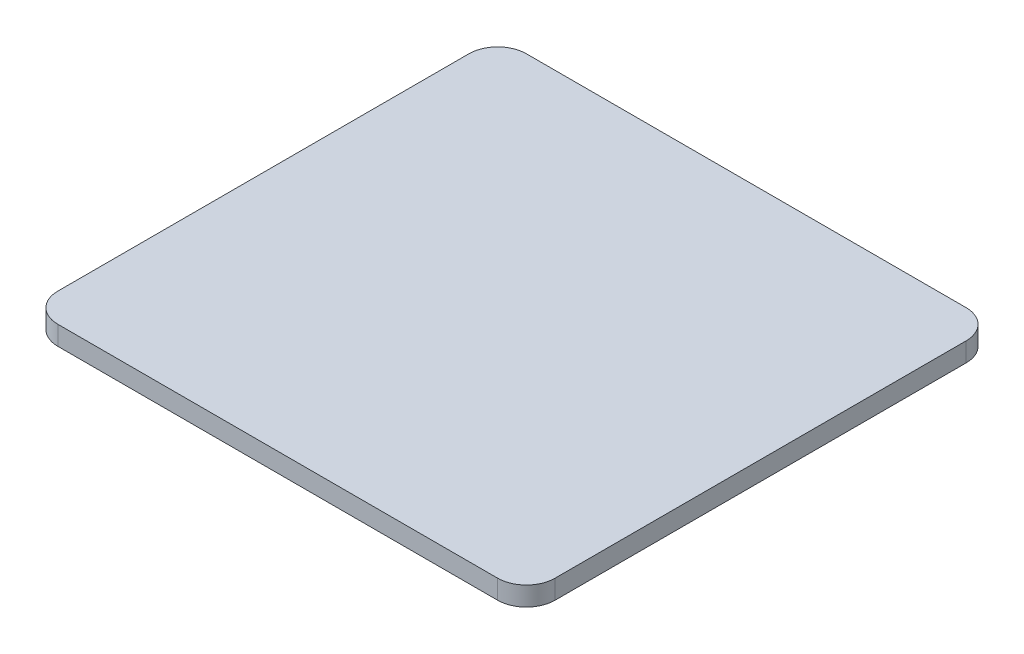
from build123d import *

# Parameters (mm, degrees)
SKETCH3_W           = 52
SKETCH3_H           = 49
BOSS_EXTRUDE3_DEPTH = 2
SKETCH5_R           = 3.5
SKETCH5_R_2         = 2.5
BOSS_EXTRUDE5_DEPTH = 3
FILLET1_R           = 3


with BuildPart() as part:
    # Sketch3 → Boss-Extrude3 (new body)
    with BuildSketch(Plane(origin=(0, 0, 0), x_dir=(1, 0, 0), z_dir=(0, 1, 0))):
        with Locations((-65.015948434, 26.335900173)):
            Rectangle(SKETCH3_W, SKETCH3_H)
    extrude(amount=BOSS_EXTRUDE3_DEPTH)

    # Sketch5 → Boss-Extrude5 (add)
    with BuildSketch(Plane.XZ):
        with Locations(Location((-62.015948434, -26.335900173, 0), (0, 0, 270))):
            Circle(SKETCH5_R)
        with Locations(Location((-62.015948434, -26.335900173, 0), (0, 0, 270))):
            Circle(SKETCH5_R_2, mode=Mode.SUBTRACT)
    extrude(amount=BOSS_EXTRUDE5_DEPTH)

    # Fillet1
    fillet1_edges = [part.edges().sort_by_distance(p)[0] for p in [
        (-39.015948434, 1, -50.835900173),
        (-39.015948434, 1, -1.835900173),
        (-91.015948434, 1, -1.835900173),
        (-91.015948434, 1, -50.835900173),
    ]]
    fillet(fillet1_edges, radius=FILLET1_R)


solid = part.part
